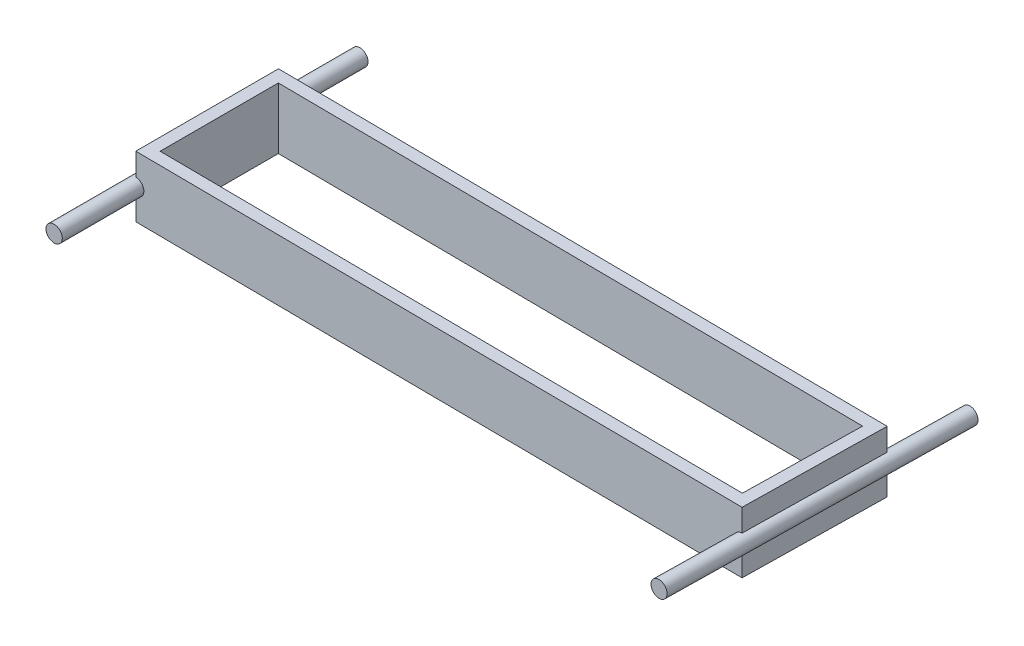
from build123d import *

# Parameters (mm, degrees)
BOSS_EXTRUDE1_DEPTH = 38.1
SKETCH2_R           = 5.08
BOSS_EXTRUDE2_DEPTH = 95.25


with BuildPart() as part:
    # Sketch1 → Boss-Extrude1 (new body)
    with BuildSketch(Plane(origin=(0, 0, 0), x_dir=(1, 0, 0), z_dir=(0, 1, 0))):
        Polygon((-323.509548329, -44.384683315), (57.476455496, -47.650397601), (59.000399511, 41.236539542), (-323.509548329, 44.515316685), align=None)
        Polygon((-315.889548329, -36.829720066), (49.987084067, -39.965920696), (51.24977094, 33.682696008), (-315.889548329, 36.829720066), align=None, mode=Mode.SUBTRACT)
    extrude(amount=-BOSS_EXTRUDE1_DEPTH)

    # Sketch2 → Boss-Extrude2 (add, symmetric)
    with BuildSketch(Plane.XY):
        with Locations((-323.509548329, -19.05)):
            Circle(SKETCH2_R)
    boss_extrude2 = extrude(amount=BOSS_EXTRUDE2_DEPTH, both=True)

    # Mirror1: Boss-Extrude2 across plane
    add(boss_extrude2.mirror(Plane(origin=(-132.612352201, 0, -1.136719062), x_dir=(-0.008571428571427947, 0, 0.9999632646313789), z_dir=(0.999963264631379, 0, 0.008571428571427946))))


solid = part.part
